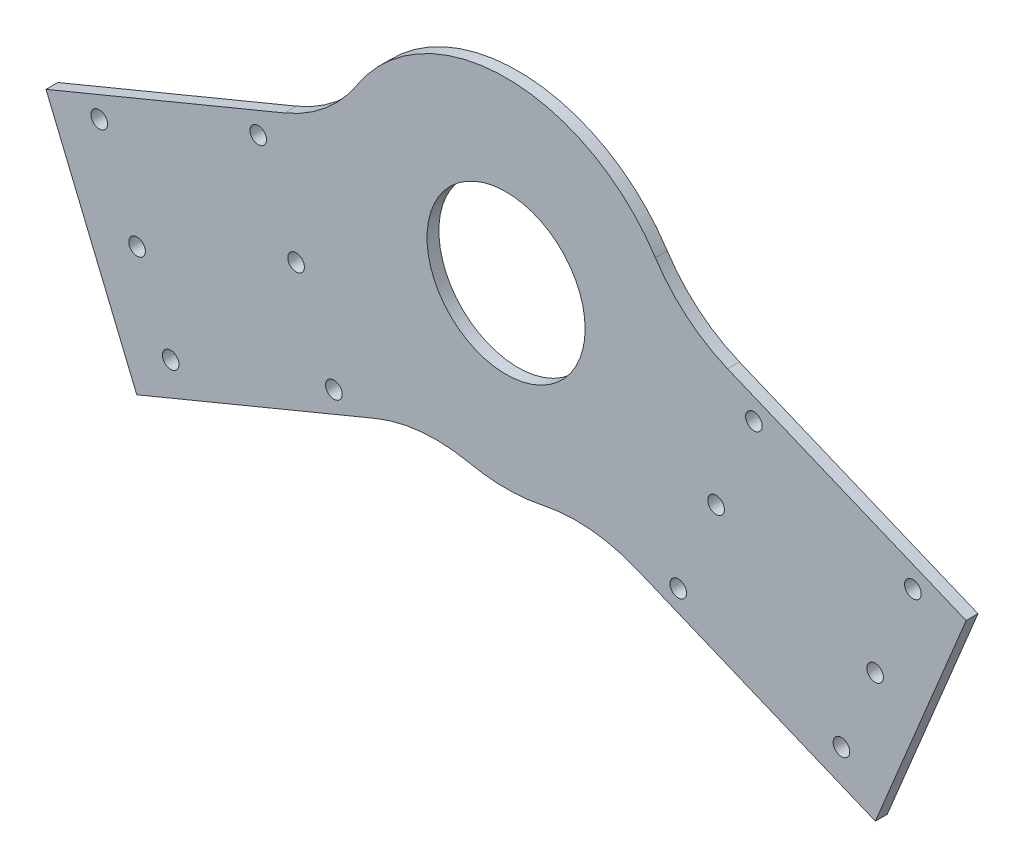
from build123d import *

# Parameters (mm, degrees)
SKETCH1_R           = 20
SKETCH1_R_2         = 2.1
BOSS_EXTRUDE1_DEPTH = 3
FILLET1_R           = 40


with BuildPart() as part:
    # Sketch1 → Boss-Extrude1 (new body)
    with BuildSketch(Plane.XY):
        with BuildLine():
            Line((-93.417721196, -71.166653094), (-116.378727138, -15.733881143))
            Line((-116.378727138, -15.733881143), (-42.468364537, 14.880793446))
            ThreePointArc((-42.468364537, 14.880793446), (0, 45), (42.468364537, 14.880793446))
            Line((42.468364537, 14.880793446), (116.378727138, -15.733881143))
            Line((116.378727138, -15.733881143), (93.417721196, -71.166653094))
            Line((93.417721196, -71.166653094), (19.507358595, -40.551978505))
            ThreePointArc((19.507358595, -40.551978505), (0, -45), (-19.507358595, -40.551978505))
            Line((-19.507358595, -40.551978505), (-93.417721196, -71.166653094))
        make_face()
        Circle(SKETCH1_R, mode=Mode.SUBTRACT)
        with Locations((-93.34973001, -38.666724214)):
            Circle(SKETCH1_R_2, mode=Mode.SUBTRACT)
        with Locations((-102.916815819, -15.569735901)):
            Circle(SKETCH1_R_2, mode=Mode.SUBTRACT)
        with Locations((-84.838757104, -59.214030433)):
            Circle(SKETCH1_R_2, mode=Mode.SUBTRACT)
        with Locations((84.838757104, -59.214030433)):
            Circle(SKETCH1_R_2, mode=Mode.SUBTRACT)
        with Locations((93.34973001, -38.666724214)):
            Circle(SKETCH1_R_2, mode=Mode.SUBTRACT)
        with Locations((102.916815819, -15.569735901)):
            Circle(SKETCH1_R_2, mode=Mode.SUBTRACT)
        with Locations((-62.691100974, 1.092300744)):
            Circle(SKETCH1_R_2, mode=Mode.SUBTRACT)
        with Locations((-53.124015165, -22.004687569)):
            Circle(SKETCH1_R_2, mode=Mode.SUBTRACT)
        with Locations((-43.556929356, -45.101675882)):
            Circle(SKETCH1_R_2, mode=Mode.SUBTRACT)
        with Locations((43.556929356, -45.101675882)):
            Circle(SKETCH1_R_2, mode=Mode.SUBTRACT)
        with Locations((53.124015165, -22.004687569)):
            Circle(SKETCH1_R_2, mode=Mode.SUBTRACT)
        with Locations((62.691100974, 1.092300744)):
            Circle(SKETCH1_R_2, mode=Mode.SUBTRACT)
    extrude(amount=BOSS_EXTRUDE1_DEPTH)

    # Fillet1
    fillet1_edges = [part.edges().sort_by_distance(p)[0] for p in [
        (-19.507358595, -40.551978505, 1.5),
        (-42.468364537, 14.880793446, 1.5),
        (42.468364537, 14.880793446, 1.5),
        (19.507358595, -40.551978505, 1.5),
    ]]
    fillet(fillet1_edges, radius=FILLET1_R)


solid = part.part
